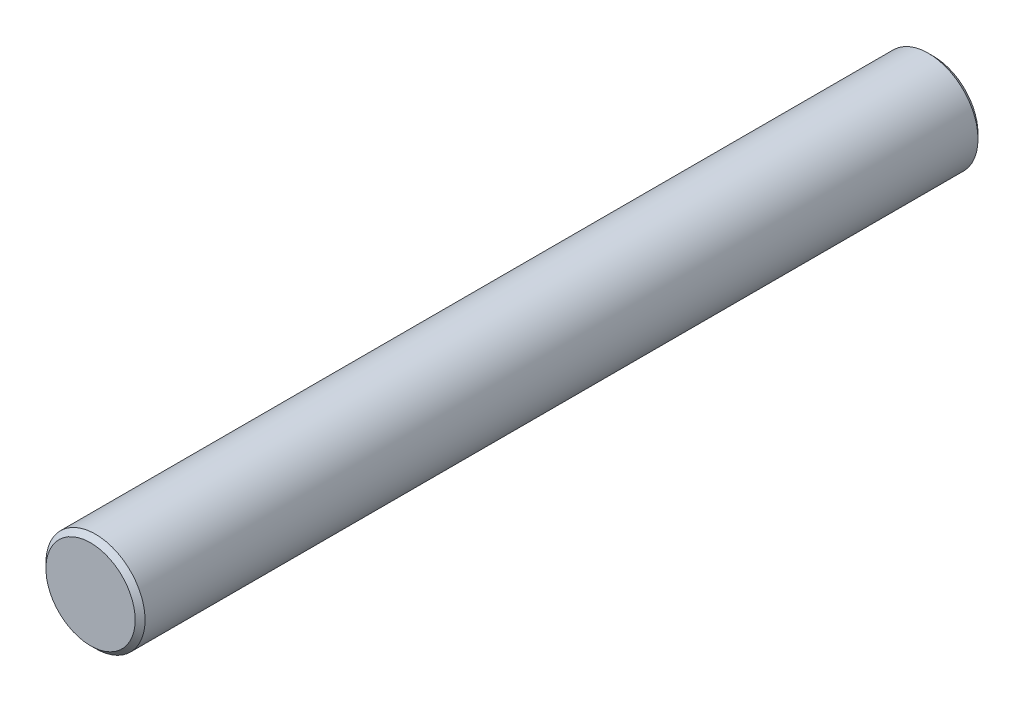
from build123d import *

# Parameters (mm, degrees)
SKETCH_1_R      = 10
EXTRUDE_1_DEPTH = 170
CHAMFER_1_SIZE  = 1


with BuildPart() as part:
    # 草图1 → 拉伸1 (new body)
    with BuildSketch(Plane.XY):
        Circle(SKETCH_1_R)
    extrude(amount=EXTRUDE_1_DEPTH)

    # 倒角1
    chamfer_1_edges = [part.edges().sort_by_distance(p)[0] for p in [
        (-10, 0, 0),
        (-10, 0, 170),
    ]]
    chamfer(chamfer_1_edges, length=CHAMFER_1_SIZE)


solid = part.part
